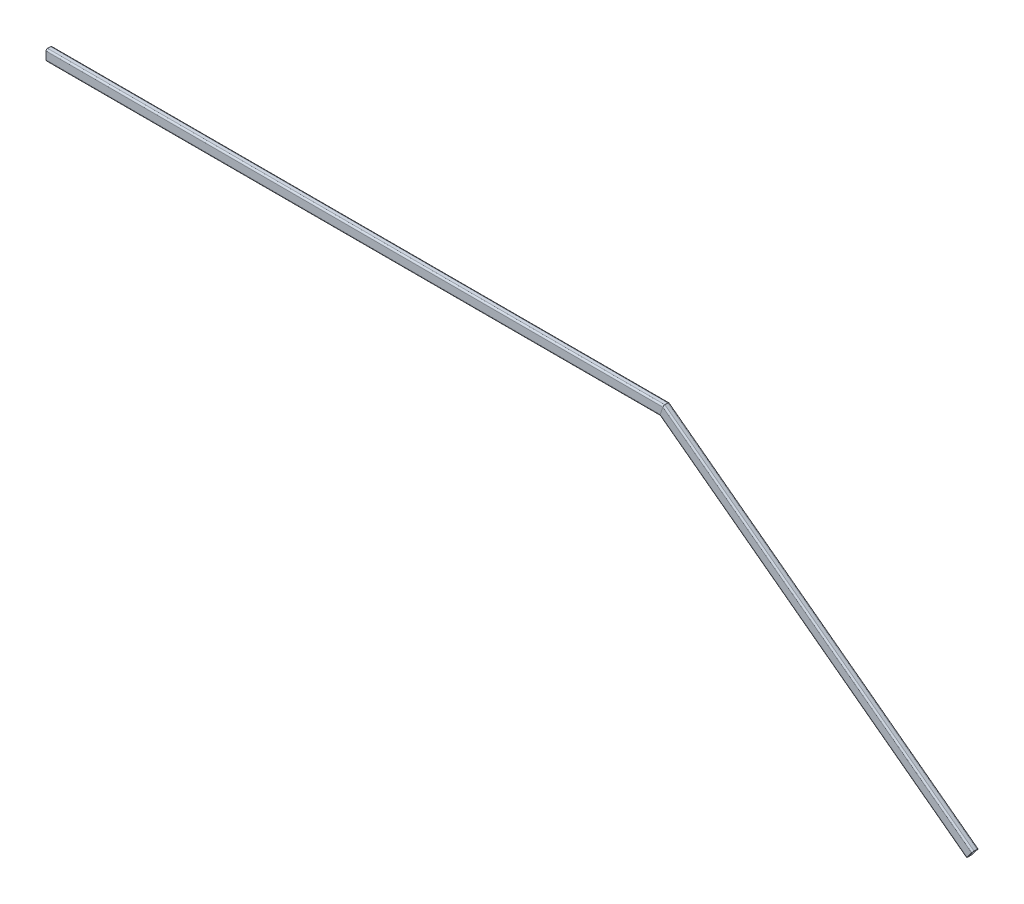
from build123d import *

# Parameters (mm, degrees)
STRUCTURAL_MEMBER1_DEPTH   = 4014.437096247
STRUCTURAL_MEMBER1_2_DEPTH = 2514.437096247


with BuildPart() as part:
    # Sketch1 → Structural Member1 (new body)
    with BuildSketch(Plane(origin=(0, 0, 0), x_dir=(0, 0, 1), z_dir=(1, 0, 0))):
        with BuildLine():
            Line((-10, -35), (10, -35))
            ThreePointArc((10, -35), (17.071067812, -32.071067812), (20, -25))
            Line((20, -25), (20, 25))
            ThreePointArc((20, 25), (17.071067812, 32.071067812), (10, 35))
            Line((10, 35), (-10, 35))
            ThreePointArc((-10, 35), (-17.071067812, 32.071067812), (-20, 25))
            Line((-20, 25), (-20, -25))
            ThreePointArc((-20, -25), (-17.071067812, -32.071067812), (-10, -35))
        make_face()
        with BuildLine():
            Line((-10, -30), (10, -30))
            ThreePointArc((10, -30), (13.535533906, -28.535533906), (15, -25))
            Line((15, -25), (15, 25))
            ThreePointArc((15, 25), (13.535533906, 28.535533906), (10, 30))
            Line((10, 30), (-10, 30))
            ThreePointArc((-10, 30), (-13.535533906, 28.535533906), (-15, 25))
            Line((-15, 25), (-15, -25))
            ThreePointArc((-15, -25), (-13.535533906, -28.535533906), (-10, -30))
        make_face(mode=Mode.SUBTRACT)
    extrude(amount=STRUCTURAL_MEMBER1_DEPTH)

    # Structural Member1 mitre 1
    split(bisect_by=Plane(origin=(4000, 0, 0), x_dir=(-0.316227766, -0.948683298, 0), z_dir=(-0.948683298, 0.316227766, 0)), keep=Keep.TOP)


with BuildPart() as body_2:
    # Sketch1 on segment 2 (carried to segment 2) → Structural Member1 2 (new body)
    with BuildSketch(Plane(origin=(3988.450323002, 8.662257748, 0), x_dir=(0, 0, 1), z_dir=(0.8, -0.6, 0))):
        with BuildLine():
            Line((-10, -35), (10, -35))
            ThreePointArc((10, -35), (17.071067812, -32.071067812), (20, -25))
            Line((20, -25), (20, 25))
            ThreePointArc((20, 25), (17.071067812, 32.071067812), (10, 35))
            Line((10, 35), (-10, 35))
            ThreePointArc((-10, 35), (-17.071067812, 32.071067812), (-20, 25))
            Line((-20, 25), (-20, -25))
            ThreePointArc((-20, -25), (-17.071067812, -32.071067812), (-10, -35))
        make_face()
        with BuildLine():
            Line((-10, -30), (10, -30))
            ThreePointArc((10, -30), (13.535533906, -28.535533906), (15, -25))
            Line((15, -25), (15, 25))
            ThreePointArc((15, 25), (13.535533906, 28.535533906), (10, 30))
            Line((10, 30), (-10, 30))
            ThreePointArc((-10, 30), (-13.535533906, 28.535533906), (-15, 25))
            Line((-15, 25), (-15, -25))
            ThreePointArc((-15, -25), (-13.535533906, -28.535533906), (-10, -30))
        make_face(mode=Mode.SUBTRACT)
    extrude(amount=STRUCTURAL_MEMBER1_2_DEPTH)

    # Structural Member1 2 mitre 1
    split(bisect_by=Plane(origin=(4000, 0, 0), x_dir=(0.316227766, 0.948683298, 0), z_dir=(0.948683298, -0.316227766, 0)), keep=Keep.TOP)


solid = Compound([part.part, body_2.part])
